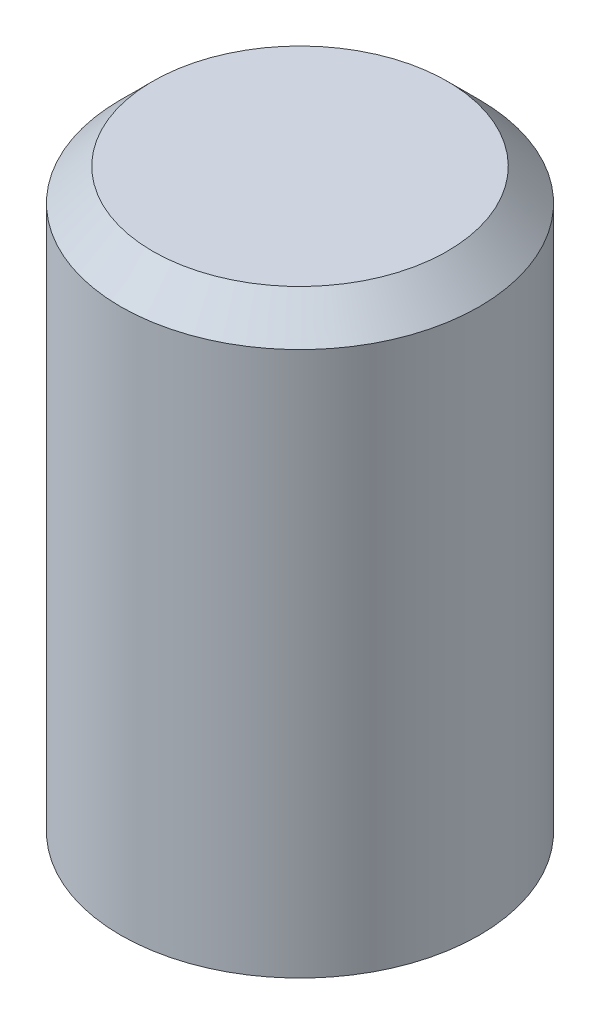
from build123d import *

# Parameters (mm, degrees)
SKETCH1_R           = 1.4
BOSS_EXTRUDE1_DEPTH = 4.5
CHAMFER1_SIZE       = 0.25


with BuildPart() as part:
    # Sketch1 → Boss-Extrude1 (new body)
    with BuildSketch(Plane(origin=(0, 0, 0), x_dir=(1, 0, 0), z_dir=(0, 1, 0))):
        with Locations(Location((0, 0, 0), (0, 0, 270))):
            Circle(SKETCH1_R)
    extrude(amount=BOSS_EXTRUDE1_DEPTH)

    # Chamfer1
    chamfer1_edges = [part.edges().sort_by_distance(p)[0] for p in [
        (0, 4.5, -1.4),
    ]]
    chamfer(chamfer1_edges, length=CHAMFER1_SIZE)


solid = part.part
